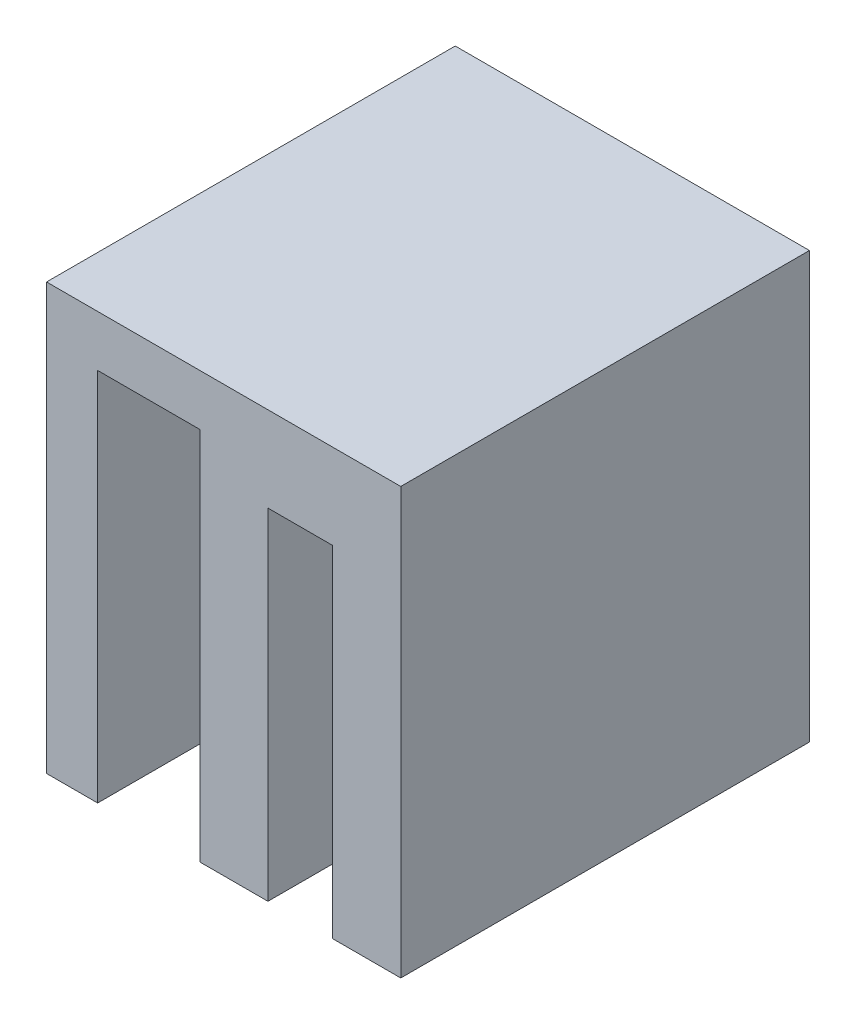
from build123d import *

# Parameters (mm, degrees)
BOSS_EXTRUDE1_DEPTH = 12


with BuildPart() as part:
    # Sketch1 → Boss-Extrude1 (new body)
    with BuildSketch(Plane.XY):
        Polygon((-3.9, -10), (-1.9, -10), (-1.9, 0), (0, 0), (0, -10), (2, -10), (2, 2.5), (-5, 2.5), (-8, 2.5), (-8.4, 2.5), (-8.4, -10), (-6.9, -10), (-6.9, -1), (-6.9, 1), (-3.9, 1), align=None)
    extrude(amount=BOSS_EXTRUDE1_DEPTH)


solid = part.part
